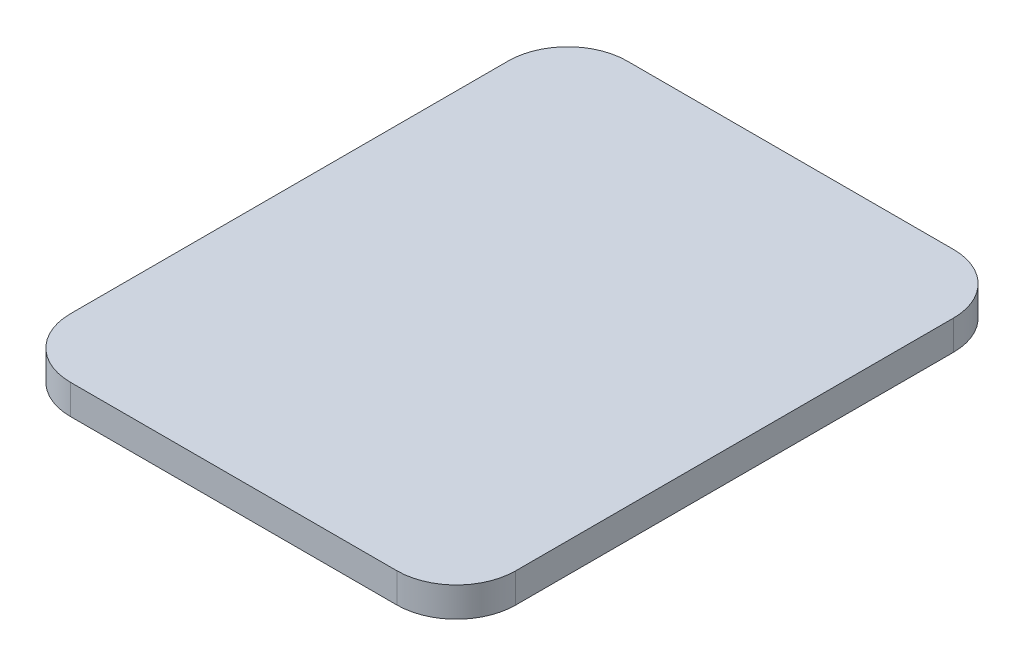
from build123d import *

# Parameters (mm, degrees)
EXTRUDE_343_DEPTH = 2


with BuildPart() as part:
    # Sketch 179 → Extrude 343 (new body)
    with BuildSketch(Plane(origin=(0, 0, 0), x_dir=(1, 0, 0), z_dir=(0, 1, 0))):
        with BuildLine():
            Line((-11, 18.75), (11, 18.75))
            ThreePointArc((11, 18.75), (13.828427125, 17.578427125), (15, 14.75))
            Line((15, 14.75), (15, -14.75))
            ThreePointArc((15, -14.75), (13.828427125, -17.578427125), (11, -18.75))
            Line((11, -18.75), (-11, -18.75))
            ThreePointArc((-11, -18.75), (-13.828427125, -17.578427125), (-15, -14.75))
            Line((-15, -14.75), (-15, 14.75))
            ThreePointArc((-15, 14.75), (-13.828427125, 17.578427125), (-11, 18.75))
        make_face()
    extrude(amount=-EXTRUDE_343_DEPTH)


solid = part.part
